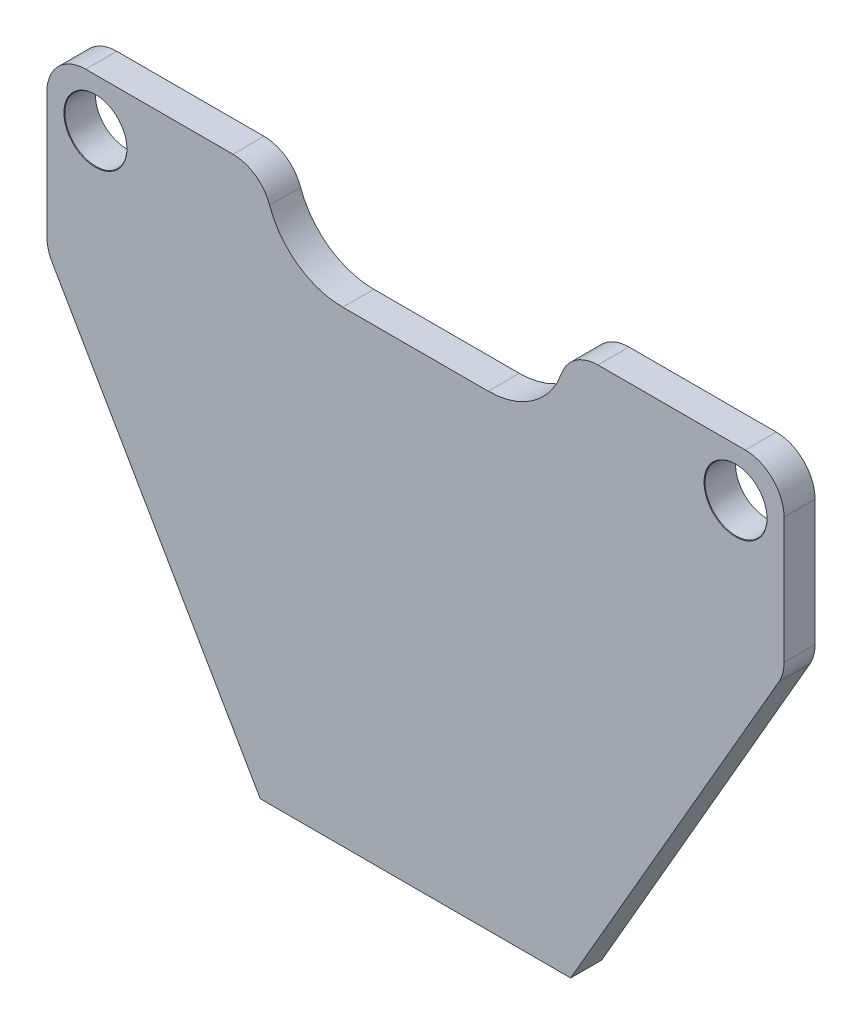
from build123d import *

# Parameters (mm, degrees)
BOSS_EXTRUDE1_DEPTH           = 1.6
M3_CLEARANCE_HOLE1_AT_2_COUNT = 2
M3_CLEARANCE_HOLE1_AT_2_PITCH = 33
FILLET1_R                     = 2


with BuildPart() as part:
    # Sketch1 → Boss-Extrude1 (new body)
    with BuildSketch(Plane.XY):
        with BuildLine():
            Line((8, 19), (-8, 19))
            Line((-8, 19), (-19, 38.052558883))
            Line((-19, 38.052558883), (-19, 47.073195958))
            Line((-19, 47.073195958), (-7.75, 47.073195958))
            ThreePointArc((-7.75, 47.073195958), (-6.578427125, 44.244768833), (-3.75, 43.073195958))
            Line((-3.75, 43.073195958), (3.75, 43.073195958))
            ThreePointArc((3.75, 43.073195958), (6.578427125, 44.244768833), (7.75, 47.073195958))
            Line((7.75, 47.073195958), (19, 47.073195958))
            Line((19, 47.073195958), (19, 38.052558883))
            Line((19, 38.052558883), (8, 19))
        make_face()
    extrude(amount=BOSS_EXTRUDE1_DEPTH)

    # Sketch3 → M3 Clearance Hole1 (revolve, cut)
    with BuildSketch(Plane(origin=(16.5, 44.573195958, 1.6), x_dir=(0, -1, 0), z_dir=(1, 0, 0))):
        Polygon((0, 0), (0, 1.6), (1.6, 1.6), (1.6, 0.025), (1.625, 0), align=None)
    m3_clearance_hole1 = revolve(axis=Axis((16.5, 44.573195958, 7.95), (0, 0, -1)), mode=Mode.SUBTRACT)

    # M3 Clearance Hole1 at 2: M3 Clearance Hole1 ×2
    with Locations(*[(-i * M3_CLEARANCE_HOLE1_AT_2_PITCH, 0, 0) for i in range(1, M3_CLEARANCE_HOLE1_AT_2_COUNT)]):
        add(m3_clearance_hole1, mode=Mode.SUBTRACT)

    # Fillet1
    fillet1_edges = [part.edges().sort_by_distance(p)[0] for p in [
        (-19, 47.073195958, 0.8),
        (-7.75, 47.073195958, 0.8),
        (7.75, 47.073195958, 0.8),
        (19, 47.073195958, 0.8),
        (19, 38.052558883, 0.8),
        (-19, 38.052558883, 0.8),
    ]]
    fillet(fillet1_edges, radius=FILLET1_R)


solid = part.part
